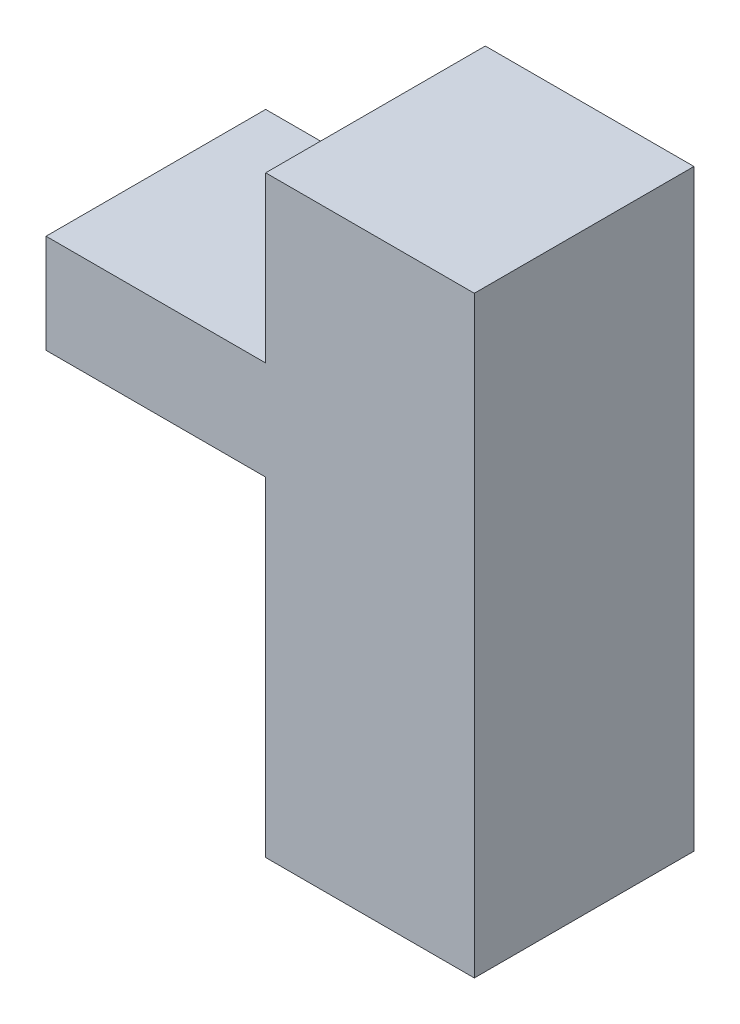
from build123d import *

# Parameters (mm, degrees)
BOSS_EXTRUDE1_DEPTH = 8


with BuildPart() as part:
    # Sketch1 → Boss-Extrude1 (new body)
    with BuildSketch(Plane.XY):
        Polygon((0.2, 0.2), (7.8, 0.2), (7.8, 21.8), (0.2, 21.8), (0.2, 15.8), (-7.8, 15.8), (-7.8, 12.2), (0.2, 12.2), align=None)
    extrude(amount=BOSS_EXTRUDE1_DEPTH)


solid = part.part
